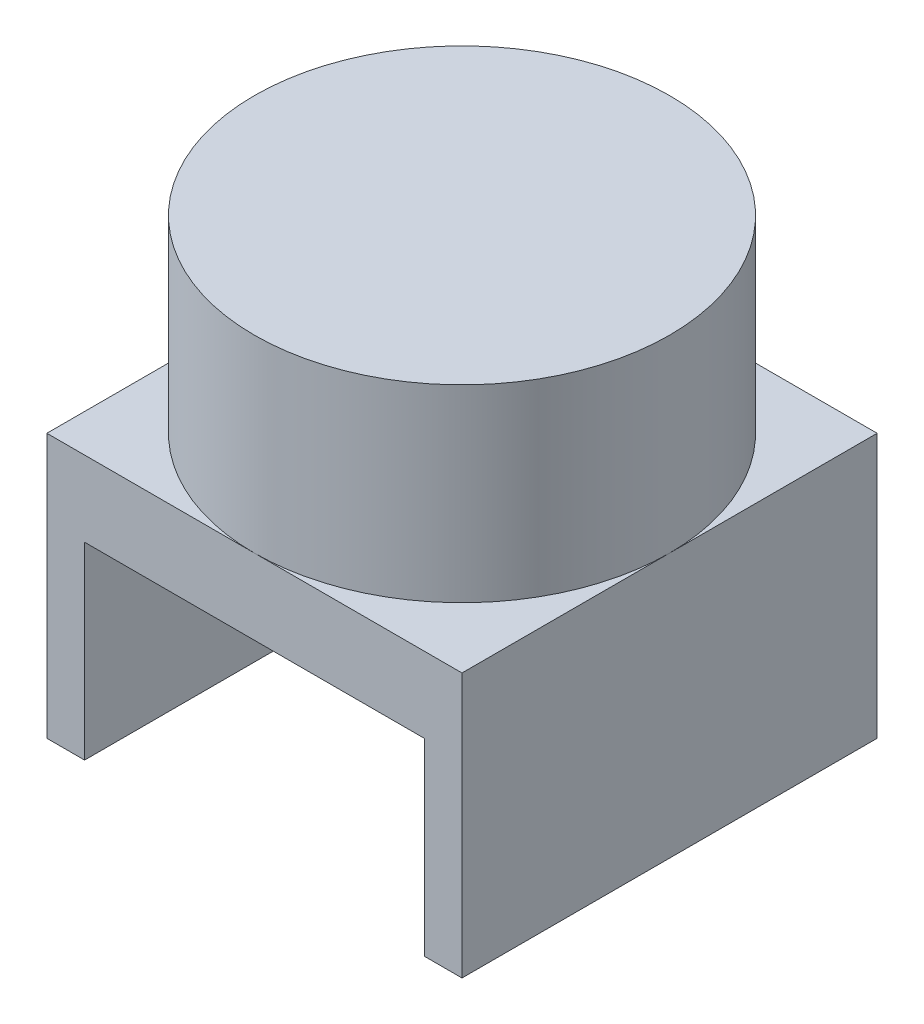
from build123d import *

# Parameters (mm, degrees)
SKETCH1_R           = 5.5
BOSS_EXTRUDE1_DEPTH = 5
SKETCH2_W           = 11
SKETCH2_H           = 11
BOSS_EXTRUDE2_DEPTH = 2
SKETCH3_W           = 1
SKETCH3_H           = 11
BOSS_EXTRUDE3_DEPTH = 5


with BuildPart() as part:
    # Sketch1 → Boss-Extrude1 (new body)
    with BuildSketch(Plane(origin=(0, 0, 0), x_dir=(1, 0, 0), z_dir=(0, 1, 0))):
        with Locations(Location((0, 0, 0), (0, 0, 270))):
            Circle(SKETCH1_R)
    extrude(amount=BOSS_EXTRUDE1_DEPTH)

    # Sketch2 → Boss-Extrude2 (add)
    with BuildSketch(Plane(origin=(0, 0, 0), x_dir=(-1, 0, 0), z_dir=(0, -1, 0))):
        Rectangle(SKETCH2_W, SKETCH2_H)
    extrude(amount=BOSS_EXTRUDE2_DEPTH)

    # Sketch3 → Boss-Extrude3 (add)
    with BuildSketch(Plane(origin=(0, -2, 0), x_dir=(-1, 0, 0), z_dir=(0, -1, 0))):
        with Locations((5, 0)):
            Rectangle(SKETCH3_W, SKETCH3_H)
        with Locations((-5, 0)):
            Rectangle(SKETCH3_W, SKETCH3_H)
    extrude(amount=BOSS_EXTRUDE3_DEPTH)


solid = part.part
